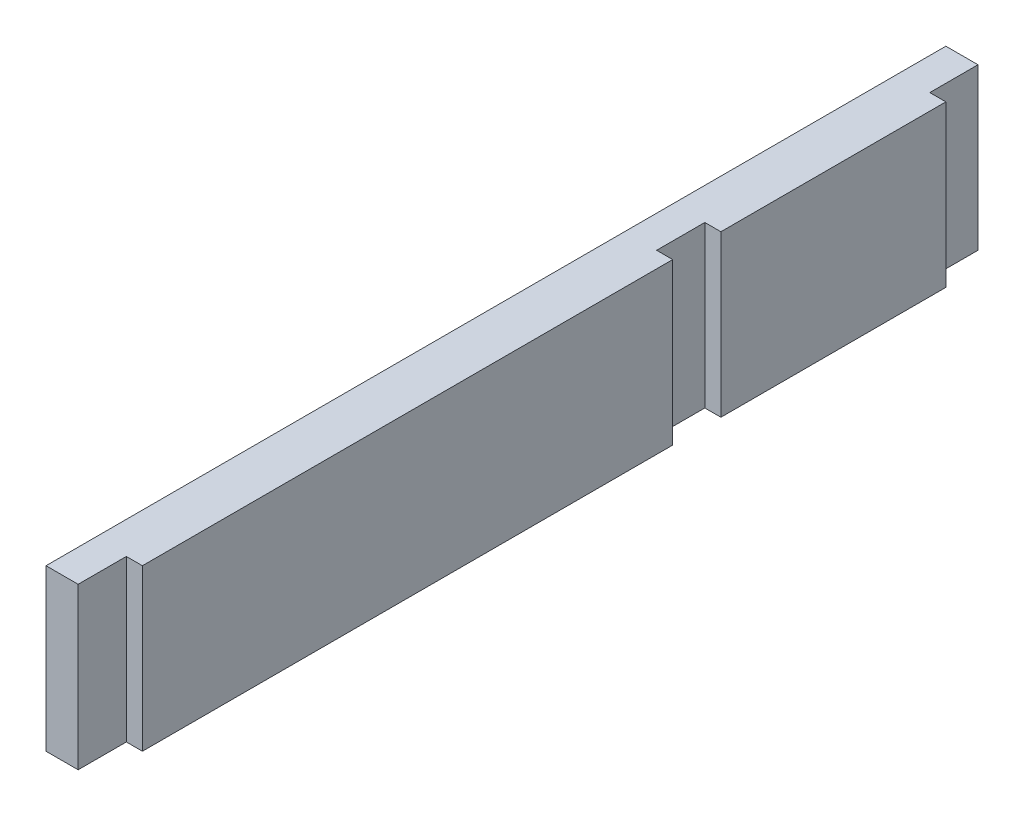
from build123d import *

# Parameters (mm, degrees)
BOSS_EXTRUDE1_DEPTH      = 15.875
BOSS_EXTRUDE1_DEPTH_BACK = 15.875


with BuildPart() as part:
    # Sketch2 → Boss-Extrude1 (new, two sides: drawn at the far end of the back side and taken through both)
    with BuildSketch(Plane(origin=(0, 0, 0), x_dir=(1, 0, 0), z_dir=(0, 1, 0)).offset(-BOSS_EXTRUDE1_DEPTH_BACK)):
        Polygon((-171.45, 88.9), (-171.45, -88.9), (-165.1, -88.9), (-165.1, -79.375), (-161.925, -79.375), (-161.925, 25.4), (-165.1, 25.4), (-165.1, 34.925), (-161.925, 34.925), (-161.925, 79.375), (-165.1, 79.375), (-165.1, 88.9), align=None)
    extrude(amount=BOSS_EXTRUDE1_DEPTH + BOSS_EXTRUDE1_DEPTH_BACK)


solid = part.part
